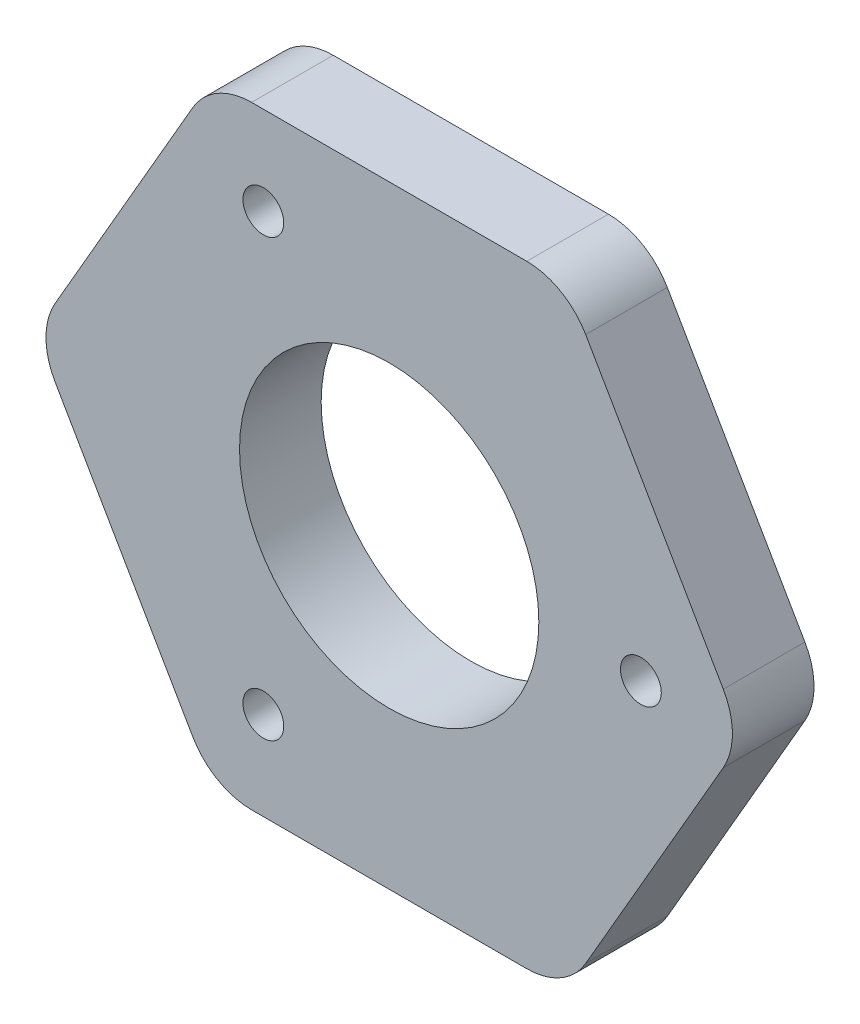
from build123d import *

# Parameters (mm, degrees)
SKETCH1_R           = 1.5
SKETCH1_R_2         = 11
BOSS_EXTRUDE1_DEPTH = 6


with BuildPart() as part:
    # Sketch1 → Boss-Extrude1 (new body)
    with BuildSketch(Plane.XY):
        with BuildLine():
            Line((-36.874473133, 91.306660498), (-57.100970441, 91.306660498))
            ThreePointArc((-57.100970441, 91.306660498), (-59.600970441, 90.636787517), (-61.43109746, 88.806660498))
            Line((-61.43109746, 88.806660498), (-71.544346114, 71.29))
            ThreePointArc((-71.544346114, 71.29), (-72.214219095, 68.79), (-71.544346114, 66.29))
            Line((-71.544346114, 66.29), (-61.43109746, 48.773339502))
            ThreePointArc((-61.43109746, 48.773339502), (-59.600970441, 46.943212483), (-57.100970441, 46.273339502))
            Line((-57.100970441, 46.273339502), (-36.874473133, 46.273339502))
            ThreePointArc((-36.874473133, 46.273339502), (-34.374473133, 46.943212483), (-32.544346114, 48.773339502))
            Line((-32.544346114, 48.773339502), (-22.43109746, 66.29))
            ThreePointArc((-22.43109746, 66.29), (-21.761224479, 68.79), (-22.43109746, 71.29))
            Line((-22.43109746, 71.29), (-32.544346114, 88.806660498))
            ThreePointArc((-32.544346114, 88.806660498), (-34.374473133, 90.636787517), (-36.874473133, 91.306660498))
        make_face()
        with Locations((-56.237721787, 52.76853003)):
            Circle(SKETCH1_R, mode=Mode.SUBTRACT)
        with Locations((-28.487721787, 68.79)):
            Circle(SKETCH1_R, mode=Mode.SUBTRACT)
        with Locations((-46.987721787, 68.79)):
            Circle(SKETCH1_R_2, mode=Mode.SUBTRACT)
        with Locations((-56.237721787, 84.81146997)):
            Circle(SKETCH1_R, mode=Mode.SUBTRACT)
    extrude(amount=BOSS_EXTRUDE1_DEPTH)


solid = part.part
